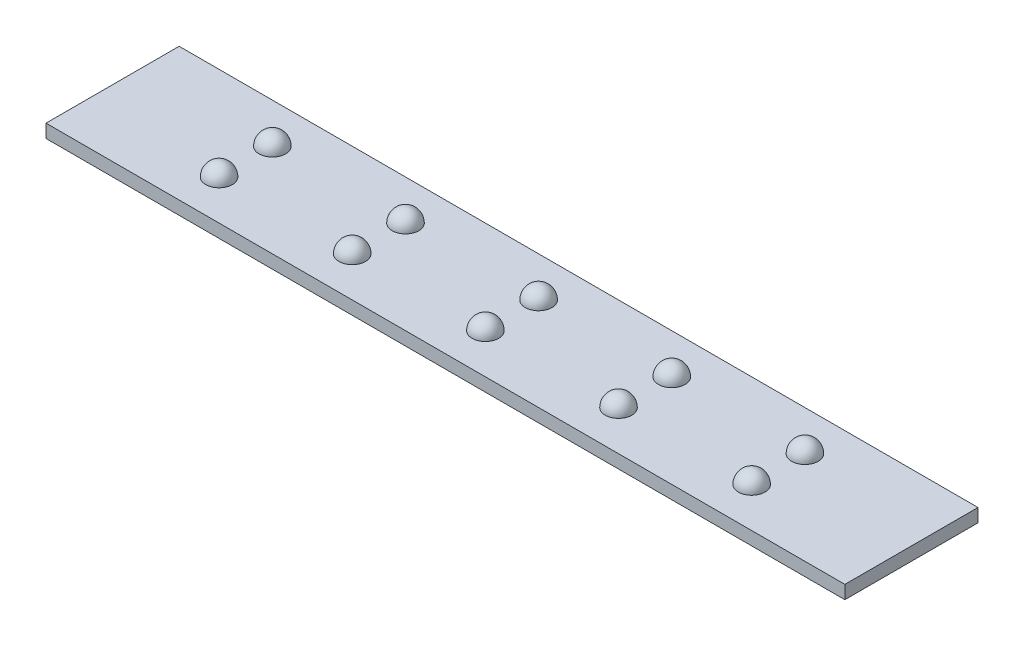
from build123d import *

# Parameters (mm, degrees)
SKETCH1_W               = 60
SKETCH1_H               = 10
BOSS_EXTRUDE1_DEPTH     = 1
REVOLVE1_ANGLE          = 180
LPATTERN1_COUNT         = 3
LPATTERN1_PITCH         = 10
LPATTERN1_COUNT_DIR2    = 2
LPATTERN1_PITCH_DIR2    = 4
LPATTERN2_COUNT         = 3
LPATTERN2_PITCH         = 10
LPATTERN2_COPY_1_ANGLE  = 180
LPATTERN2_COPY_2_ANGLE  = 180
LPATTERN2_COPY_3_ANGLE  = 180
LPATTERN2_COPY_4_ANGLE  = 180
LPATTERN2_COPY_5_ANGLE  = 180
LPATTERN2_COPY_6_ANGLE  = 180
LPATTERN2_COPY_7_ANGLE  = 180
LPATTERN2_COPY_8_ANGLE  = 180
LPATTERN2_COPY_9_ANGLE  = 180
LPATTERN2_COPY_10_ANGLE = 180


with BuildPart() as part:
    # Sketch1 → Boss-Extrude1 (new body)
    with BuildSketch(Plane(origin=(0, 0, 0), x_dir=(1, 0, 0), z_dir=(0, 1, 0))):
        Rectangle(SKETCH1_W, SKETCH1_H)
    extrude(amount=BOSS_EXTRUDE1_DEPTH)

    # Sketch3 → Revolve1 (revolve)
    with BuildSketch(Plane(origin=(0, 1, 0), x_dir=(1, 0, 0), z_dir=(0, 1, 0))):
        with BuildLine():
            Line((-1, -2), (1, -2))
            ThreePointArc((1, -2), (0, -3), (-1, -2))
        make_face()
    revolve1 = revolve(axis=Axis((-1, 1, 2), (-1, 0, 0)), revolution_arc=REVOLVE1_ANGLE)

    # LPattern1: Revolve1 3 × 2
    with Locations(*[(-i * LPATTERN1_PITCH, 0, -j * LPATTERN1_PITCH_DIR2) for i in range(LPATTERN1_COUNT) for j in range(LPATTERN1_COUNT_DIR2) if (i, j) != (0, 0)]):
        add(revolve1)

    # LPattern2: Revolve1 ×3
    with Locations(*[(i * LPATTERN2_PITCH, 0, 0) for i in range(1, LPATTERN2_COUNT)]):
        add(revolve1)

    # LPattern2 copy 1 sketch → LPattern2 copy 1 (revolve)
    with BuildSketch(Plane(origin=(10, 1, -4), x_dir=(1, 0, 0), z_dir=(0, 1, 0))):
        with BuildLine():
            Line((-1, -2), (1, -2))
            ThreePointArc((1, -2), (0, -3), (-1, -2))
        make_face()
    revolve(axis=Axis((9, 1, -2), (-1, 0, 0)), revolution_arc=LPATTERN2_COPY_1_ANGLE)

    # LPattern2 copy 2 sketch → LPattern2 copy 2 (revolve)
    with BuildSketch(Plane(origin=(20, 1, -4), x_dir=(1, 0, 0), z_dir=(0, 1, 0))):
        with BuildLine():
            Line((-1, -2), (1, -2))
            ThreePointArc((1, -2), (0, -3), (-1, -2))
        make_face()
    revolve(axis=Axis((19, 1, -2), (-1, 0, 0)), revolution_arc=LPATTERN2_COPY_2_ANGLE)

    # LPattern2 copy 3 sketch → LPattern2 copy 3 (revolve)
    with BuildSketch(Plane(origin=(0, 1, 0), x_dir=(1, 0, 0), z_dir=(0, 1, 0))):
        with BuildLine():
            Line((-1, -2), (1, -2))
            ThreePointArc((1, -2), (0, -3), (-1, -2))
        make_face()
    revolve(axis=Axis((-1, 1, 2), (-1, 0, 0)), revolution_arc=LPATTERN2_COPY_3_ANGLE)

    # LPattern2 copy 4 sketch → LPattern2 copy 4 (revolve)
    with BuildSketch(Plane(origin=(10, 1, 0), x_dir=(1, 0, 0), z_dir=(0, 1, 0))):
        with BuildLine():
            Line((-1, -2), (1, -2))
            ThreePointArc((1, -2), (0, -3), (-1, -2))
        make_face()
    revolve(axis=Axis((9, 1, 2), (-1, 0, 0)), revolution_arc=LPATTERN2_COPY_4_ANGLE)

    # LPattern2 copy 5 sketch → LPattern2 copy 5 (revolve)
    with BuildSketch(Plane(origin=(0, 1, -4), x_dir=(1, 0, 0), z_dir=(0, 1, 0))):
        with BuildLine():
            Line((-1, -2), (1, -2))
            ThreePointArc((1, -2), (0, -3), (-1, -2))
        make_face()
    revolve(axis=Axis((-1, 1, -2), (-1, 0, 0)), revolution_arc=LPATTERN2_COPY_5_ANGLE)

    # LPattern2 copy 6 sketch → LPattern2 copy 6 (revolve)
    with BuildSketch(Plane(origin=(10, 1, -4), x_dir=(1, 0, 0), z_dir=(0, 1, 0))):
        with BuildLine():
            Line((-1, -2), (1, -2))
            ThreePointArc((1, -2), (0, -3), (-1, -2))
        make_face()
    revolve(axis=Axis((9, 1, -2), (-1, 0, 0)), revolution_arc=LPATTERN2_COPY_6_ANGLE)

    # LPattern2 copy 7 sketch → LPattern2 copy 7 (revolve)
    with BuildSketch(Plane(origin=(-10, 1, 0), x_dir=(1, 0, 0), z_dir=(0, 1, 0))):
        with BuildLine():
            Line((-1, -2), (1, -2))
            ThreePointArc((1, -2), (0, -3), (-1, -2))
        make_face()
    revolve(axis=Axis((-11, 1, 2), (-1, 0, 0)), revolution_arc=LPATTERN2_COPY_7_ANGLE)

    # LPattern2 copy 8 sketch → LPattern2 copy 8 (revolve)
    with BuildSketch(Plane(origin=(0, 1, 0), x_dir=(1, 0, 0), z_dir=(0, 1, 0))):
        with BuildLine():
            Line((-1, -2), (1, -2))
            ThreePointArc((1, -2), (0, -3), (-1, -2))
        make_face()
    revolve(axis=Axis((-1, 1, 2), (-1, 0, 0)), revolution_arc=LPATTERN2_COPY_8_ANGLE)

    # LPattern2 copy 9 sketch → LPattern2 copy 9 (revolve)
    with BuildSketch(Plane(origin=(-10, 1, -4), x_dir=(1, 0, 0), z_dir=(0, 1, 0))):
        with BuildLine():
            Line((-1, -2), (1, -2))
            ThreePointArc((1, -2), (0, -3), (-1, -2))
        make_face()
    revolve(axis=Axis((-11, 1, -2), (-1, 0, 0)), revolution_arc=LPATTERN2_COPY_9_ANGLE)

    # LPattern2 copy 10 sketch → LPattern2 copy 10 (revolve)
    with BuildSketch(Plane(origin=(0, 1, -4), x_dir=(1, 0, 0), z_dir=(0, 1, 0))):
        with BuildLine():
            Line((-1, -2), (1, -2))
            ThreePointArc((1, -2), (0, -3), (-1, -2))
        make_face()
    revolve(axis=Axis((-1, 1, -2), (-1, 0, 0)), revolution_arc=LPATTERN2_COPY_10_ANGLE)


solid = part.part
